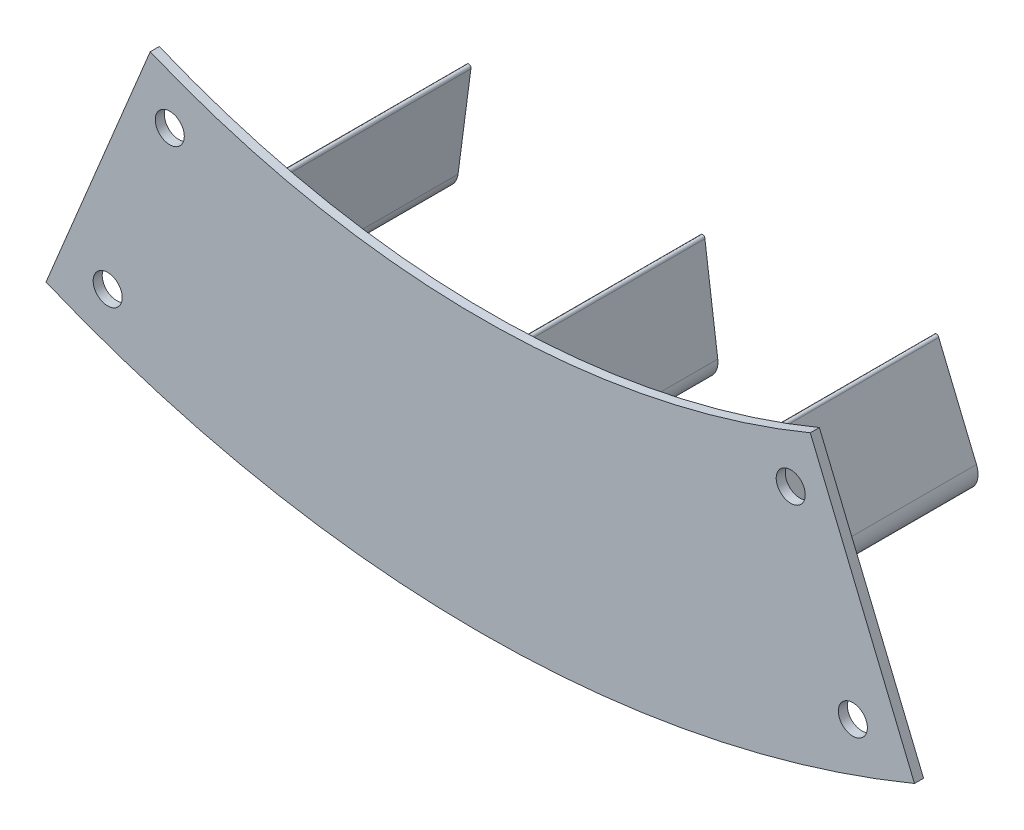
from build123d import *

# Parameters (mm, degrees)
BOSS_EXTRUDE1_START      = -5
BOSS_EXTRUDE1_DEPTH      = 1
BOSS_EXTRUDE2_START      = -5
BOSS_EXTRUDE2_DEPTH      = 5
BOSS_EXTRUDE3_DEPTH      = 1
BOSS_EXTRUDE3_DEPTH_BACK = 6
BOSS_EXTRUDE4_DEPTH      = 23.5
CUT_EXTRUDE1_START       = -6
CUT_EXTRUDE1_DEPTH       = 6
CUT_EXTRUDE2_DEPTH       = 137.064243179
CUT_EXTRUDE2_DEPTH_BACK  = 137.064243179
SKETCH5_R                = 1.6


with BuildPart() as part:
    # Sketch1 → Boss-Extrude1 (new body)
    with BuildSketch(Plane.XY.offset(BOSS_EXTRUDE1_START)):
        with BuildLine():
            Line((-47.835429046, -115.484941564), (-36.354926075, -87.768555589))
            ThreePointArc((-36.354926075, -87.768555589), (0, -95), (36.354926075, -87.768555589))
            Line((36.354926075, -87.768555589), (47.835429046, -115.484941564))
            ThreePointArc((47.835429046, -115.484941564), (0, -125), (-47.835429046, -115.484941564))
        make_face()
        with BuildLine():
            Line((-26.038476963, -106.101650399), (-23.955923749, -97.86049365))
            ThreePointArc((-23.955923749, -97.86049365), (0, -100.75), (23.955923749, -97.86049365))
            Line((23.955923749, -97.86049365), (26.038476963, -106.101650399))
            ThreePointArc((26.038476963, -106.101650399), (0, -109.25), (-26.038476963, -106.101650399))
        make_face(mode=Mode.SUBTRACT)
    extrude(amount=-BOSS_EXTRUDE1_DEPTH)



with BuildPart() as body_2:
    # Sketch1<3> → Boss-Extrude2 (new body)
    with BuildSketch(Plane.XY.offset(BOSS_EXTRUDE2_START)):
        with BuildLine():
            ThreePointArc((-23.955923749, -97.86049365), (0, -100.75), (23.955923749, -97.86049365))
            Line((23.955923749, -97.86049365), (26.038476963, -106.101650399))
            ThreePointArc((26.038476963, -106.101650399), (0, -109.25), (-26.038476963, -106.101650399))
            Line((-26.038476963, -106.101650399), (-23.955923749, -97.86049365))
        make_face()
    extrude(amount=BOSS_EXTRUDE2_DEPTH)


with BuildPart() as part_1:
    add(part.part)

    add(body_2.part)  # Boss-Extrude3 merges body 2
    # Sketch1<4> → Boss-Extrude3 (add, two sides: drawn at the far end of the back side and taken through both)
    with BuildSketch(Plane.XY.offset(-BOSS_EXTRUDE3_DEPTH_BACK)):
        with BuildLine():
            ThreePointArc((-23.955923749, -97.86049365), (0, -100.75), (23.955923749, -97.86049365))
            Line((23.955923749, -97.86049365), (26.038476963, -106.101650399))
            ThreePointArc((26.038476963, -106.101650399), (0, -109.25), (-26.038476963, -106.101650399))
            Line((-26.038476963, -106.101650399), (-23.955923749, -97.86049365))
        make_face()
    extrude(amount=BOSS_EXTRUDE3_DEPTH + BOSS_EXTRUDE3_DEPTH_BACK)

    # Sketch3 → Boss-Extrude4 (add)
    with BuildSketch(Plane(origin=(0, 0, -6), x_dir=(-1, 0, 0), z_dir=(0, 0, -1))):
        with BuildLine():
            Line((-25.529686705, -96.235678696), (-26.946588628, -106.998117309))
            ThreePointArc((-26.946588628, -106.998117309), (-27.363549694, -108.035848526), (-28.228626172, -108.744639958))
            ThreePointArc((-28.228626172, -108.744639958), (-29.159731718, -108.825600307), (-29.9256126, -108.289933815))
            ThreePointArc((-29.9256126, -108.289933815), (-30.32039509, -107.24356419), (-30.162628357, -106.136382061))
            Line((-30.162628357, -106.136382061), (-26.008482111, -96.107385854))
            ThreePointArc((-26.008482111, -96.107385854), (-25.695897738, -95.898395904), (-25.529686705, -96.235678696))
        make_face()
        with BuildLine():
            Line((0.24784274, -99.564096598), (1.664744663, -110.326535211))
            ThreePointArc((1.664744663, -110.326535211), (1.530575804, -111.436824058), (0.878424814, -112.345362277))
            ThreePointArc((0.878424814, -112.345362277), (0, -112.664551817), (-0.878424814, -112.345362277))
            ThreePointArc((-0.878424814, -112.345362277), (-1.530575804, -111.436824058), (-1.664744663, -110.326535211))
            Line((-1.664744663, -110.326535211), (-0.24784274, -99.564096598))
            ThreePointArc((-0.24784274, -99.564096598), (0, -99.281325019), (0.24784274, -99.564096598))
        make_face()
        with BuildLine():
            Line((26.008482111, -96.107385854), (30.162628357, -106.136382061))
            ThreePointArc((30.162628357, -106.136382061), (30.32039509, -107.24356419), (29.9256126, -108.289933815))
            ThreePointArc((29.9256126, -108.289933815), (29.159731718, -108.825600307), (28.228626172, -108.744639958))
            ThreePointArc((28.228626172, -108.744639958), (27.363549694, -108.035848526), (26.946588628, -106.998117309))
            Line((26.946588628, -106.998117309), (25.529686705, -96.235678696))
            ThreePointArc((25.529686705, -96.235678696), (25.695897738, -95.898395904), (26.008482111, -96.107385854))
        make_face()
    extrude(amount=BOSS_EXTRUDE4_DEPTH)

    # Sketch4 → Cut-Extrude1 (cut)
    with BuildSketch(Plane.XY.offset(1).offset(CUT_EXTRUDE1_START)):
        with BuildLine():
            Line((-23.955923749, -97.86049365), (-26.038476963, -106.101650399))
            ThreePointArc((-26.038476963, -106.101650399), (0, -109.25), (26.038476963, -106.101650399))
            Line((26.038476963, -106.101650399), (23.955923749, -97.86049365))
            ThreePointArc((23.955923749, -97.86049365), (0, -100.75), (-23.955923749, -97.86049365))
        make_face()
    extrude(amount=CUT_EXTRUDE1_DEPTH, mode=Mode.SUBTRACT)

    # Sketch5 → Cut-Extrude2 (cut, two sides: drawn at the far end of the back side and taken through both)
    with BuildSketch(Plane.XY.offset(-5).offset(-CUT_EXTRUDE2_DEPTH_BACK)):
        with Locations((-34.202014333, -93.969262079)):
            Circle(SKETCH5_R)
        with Locations((-41.042417199, -112.763114494)):
            Circle(SKETCH5_R)
        with Locations((41.042417199, -112.763114494)):
            Circle(SKETCH5_R)
        with Locations((34.202014333, -93.969262079)):
            Circle(SKETCH5_R)
    extrude(amount=CUT_EXTRUDE2_DEPTH + CUT_EXTRUDE2_DEPTH_BACK, mode=Mode.SUBTRACT)


solid = part_1.part
